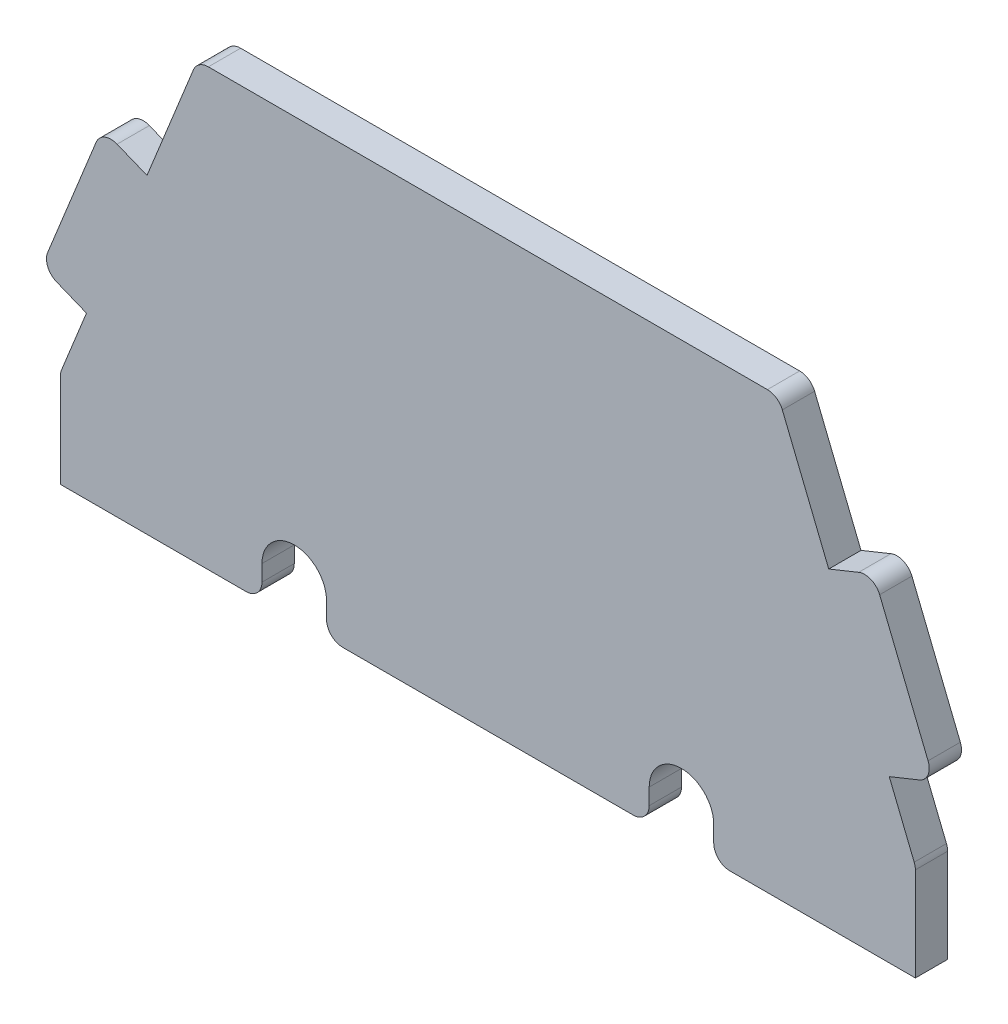
from build123d import *

# Parameters (mm, degrees)
RESSALTO_EXTRUS_O1_DEPTH = 2


with BuildPart() as part:
    # Esboço1 → Ressalto-extrusão1 (new body)
    with BuildSketch(Plane.XY):
        with BuildLine():
            Line((-26.426946813, -7.319515656), (-24.880952381, -3.5))
            Line((-24.880952381, -3.5), (-26.734846007, -2.749614485))
            ThreePointArc((-26.734846007, -2.749614485), (-27.28040497, -2.212816705), (-27.286600063, -1.447474914))
            Line((-27.286600063, -1.447474914), (-24.285058001, 5.968099592))
            ThreePointArc((-24.285058001, 5.968099592), (-23.748260222, 6.513658555), (-22.98291843, 6.519853648))
            Line((-22.98291843, 6.519853648), (-21.129024804, 5.769468132))
            Line((-21.129024804, 5.769468132), (-18.252898169, 12.875192758))
            ThreePointArc((-18.252898169, 12.875192758), (-17.88488214, 13.329214314), (-17.325951356, 13.5))
            Line((-17.325951356, 13.5), (17.325951356, 13.5))
            ThreePointArc((17.325951356, 13.5), (17.88488214, 13.329214314), (18.252898169, 12.875192758))
            Line((18.252898169, 12.875192758), (21.129024804, 5.769468132))
            Line((21.129024804, 5.769468132), (22.98291843, 6.519853648))
            ThreePointArc((22.98291843, 6.519853648), (23.748260222, 6.513658555), (24.285058001, 5.968099592))
            Line((24.285058001, 5.968099592), (27.286600063, -1.447474914))
            ThreePointArc((27.286600063, -1.447474914), (27.28040497, -2.212816705), (26.734846007, -2.749614485))
            Line((26.734846007, -2.749614485), (24.880952381, -3.5))
            Line((24.880952381, -3.5), (26.426946813, -7.319515656))
            ThreePointArc((26.426946813, -7.319515656), (26.481566812, -7.503589097), (26.5, -7.694708414))
            Line((26.5, -7.694708414), (26.5, -13.5))
            Line((26.5, -13.5), (15, -13.5))
            ThreePointArc((15, -13.5), (14.292893219, -13.207106781), (14, -12.5))
            Line((14, -12.5), (14, -11.5))
            ThreePointArc((14, -11.5), (12, -9.5), (10, -11.5))
            Line((10, -11.5), (10, -12.5))
            ThreePointArc((10, -12.5), (9.707106781, -13.207106781), (9, -13.5))
            Line((9, -13.5), (-9, -13.5))
            ThreePointArc((-9, -13.5), (-9.707106781, -13.207106781), (-10, -12.5))
            Line((-10, -12.5), (-10, -11.5))
            ThreePointArc((-10, -11.5), (-12, -9.5), (-14, -11.5))
            Line((-14, -11.5), (-14, -12.5))
            ThreePointArc((-14, -12.5), (-14.292893219, -13.207106781), (-15, -13.5))
            Line((-15, -13.5), (-26.5, -13.5))
            Line((-26.5, -13.5), (-26.5, -7.694708414))
            ThreePointArc((-26.5, -7.694708414), (-26.481566812, -7.503589097), (-26.426946813, -7.319515656))
        make_face()
    extrude(amount=RESSALTO_EXTRUS_O1_DEPTH)


solid = part.part
